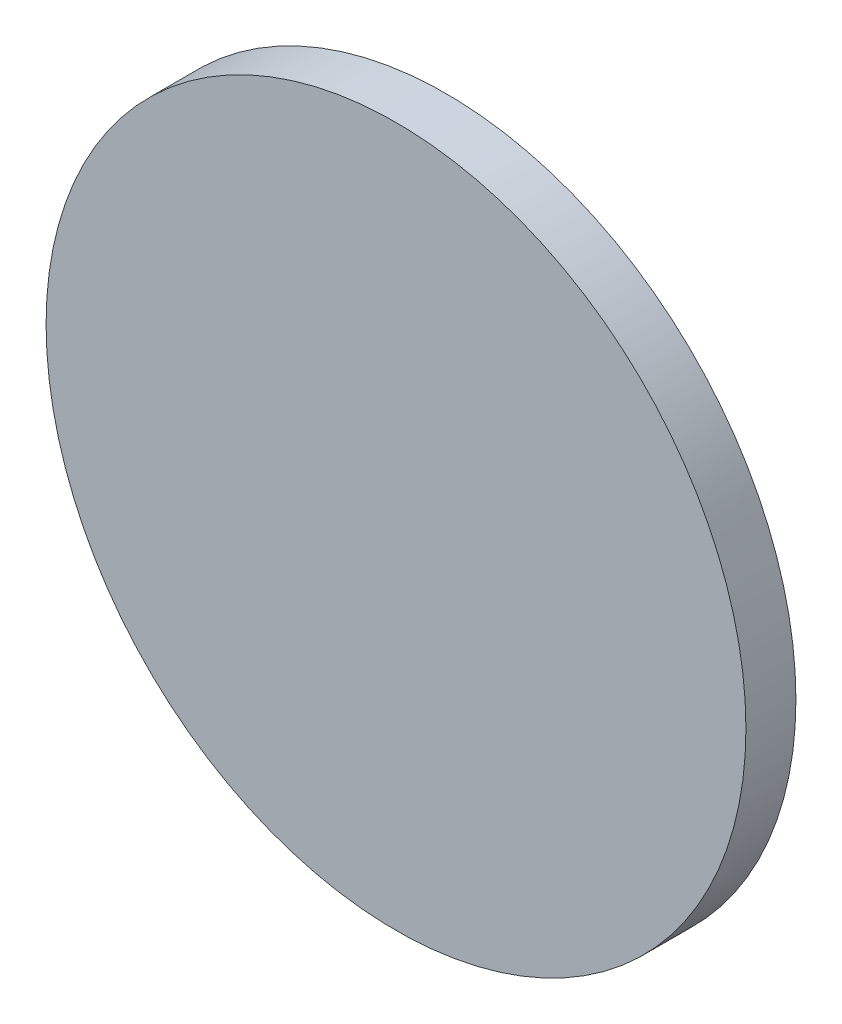
from build123d import *

# Parameters (mm, degrees)
SKETCH1_R           = 7
BOSS_EXTRUDE1_DEPTH = 1


with BuildPart() as part:
    # Sketch1 → Boss-Extrude1 (new body)
    with BuildSketch(Plane.XY):
        Circle(SKETCH1_R)
    extrude(amount=BOSS_EXTRUDE1_DEPTH)


solid = part.part
